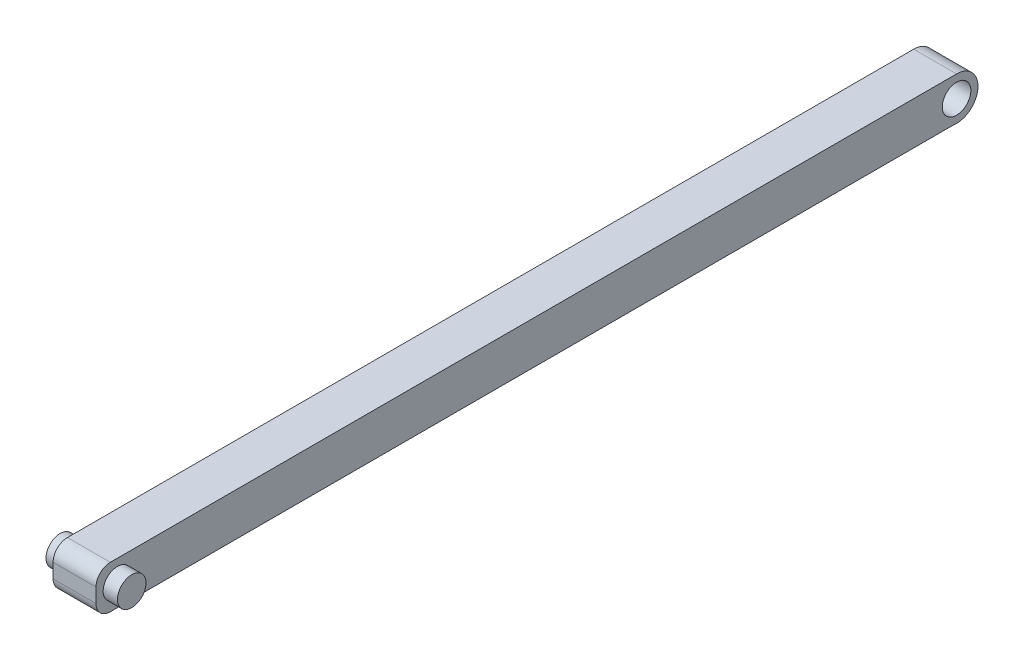
from build123d import *

# Parameters (mm, degrees)
SKETCH1_R                = 5
BOSS_EXTRUDE1_DEPTH      = 15
BOSS_EXTRUDE3_DEPTH      = 5
BOSS_EXTRUDE3_DEPTH_BACK = 20
SKETCH4_R                = 5
FILLET1_R                = 5


with BuildPart() as part:
    # Sketch1 → Boss-Extrude1 (new body)
    with BuildSketch(Plane(origin=(0, 0, 0), x_dir=(0, 0, -1), z_dir=(1, 0, 0))):
        with BuildLine():
            Line((-201.009068176, 7.568692759), (100, 7.5))
            ThreePointArc((100, 7.5), (107.48293277, -0.50568484), (98.990931823, -7.431808758))
            Line((98.990931823, -7.431808758), (-201.009068176, -7.431307241))
            Line((-201.009068176, -7.431307241), (-201.009068176, 7.568692759))
        make_face()
        with Locations((100, 0)):
            Circle(SKETCH1_R, mode=Mode.SUBTRACT)
    extrude(amount=BOSS_EXTRUDE1_DEPTH)

    # Sketch4 → Boss-Extrude3 (add, two sides: drawn at the far end of the back side and taken through both)
    with BuildSketch(Plane(origin=(15, 0, 0), x_dir=(0, 0, -1), z_dir=(1, 0, 0)).offset(-BOSS_EXTRUDE3_DEPTH_BACK)):
        with Locations((-193.509068176, 0.066981001)):
            Circle(SKETCH4_R)
    extrude(amount=BOSS_EXTRUDE3_DEPTH + BOSS_EXTRUDE3_DEPTH_BACK)

    # Fillet1
    fillet1_edges = [part.edges().sort_by_distance(p)[0] for p in [
        (7.5, 7.568692759, 201.009068176),
        (7.5, -7.431307241, 201.009068176),
    ]]
    fillet(fillet1_edges, radius=FILLET1_R)


solid = part.part
